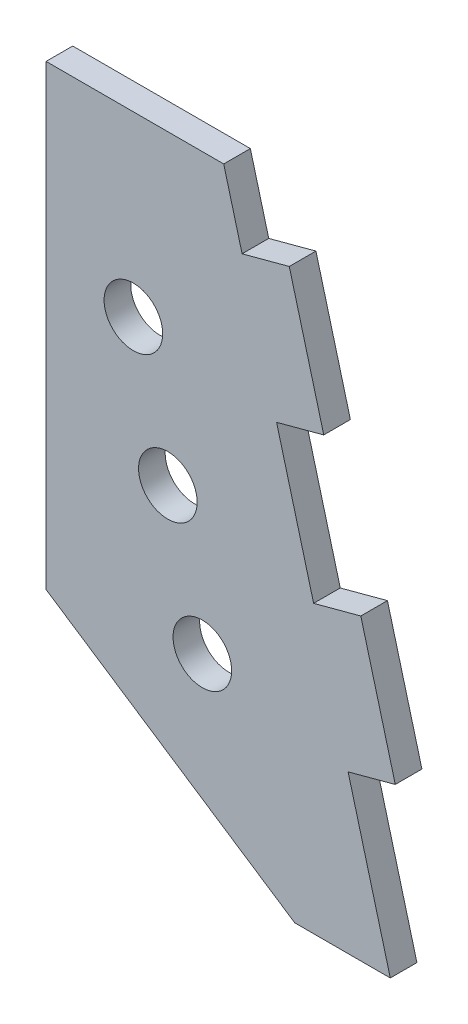
from build123d import *

# Parameters (mm, degrees)
RESSALTO_EXTRUS_O1_DEPTH = 3
FURO_COM_FOLGA_DE_M61_D  = 6.6
RESSALTO_EXTRUS_O2_DEPTH = 3
RESSALTO_EXTRUS_O3_DEPTH = 3
CORTE_EXTRUS_O1_DEPTH    = 72.798210781


with BuildPart() as part:
    # Esboço1 → Ressalto-extrusão1 (new body)
    with BuildSketch(Plane.XY):
        Polygon((0, 0), (0, 60), (20, 60), (36.076951546, 0), align=None)
    extrude(amount=RESSALTO_EXTRUS_O1_DEPTH)

    # Furo com folga de M61 (through all)
    with Locations(Plane.XY.offset(3)):
        with Locations((9.829841142, 40), (13.712126819, 25.511112606), (17.594412496, 11.022225211)):
            Hole(FURO_COM_FOLGA_DE_M61_D / 2)

    # Esboço4 → Ressalto-extrusão2 (add)
    with BuildSketch(Plane.XY.offset(3)):
        Polygon((22.070552361, 52.27259339), (27.383144405, 53.696098138), (31.265430082, 39.207210743), (25.952838037, 37.783705995), align=None)
        Polygon((30.124113509, 22.216294005), (35.436705553, 23.639798753), (39.31899123, 9.150911358), (34.006399185, 7.72740661), align=None)
    extrude(amount=-RESSALTO_EXTRUS_O2_DEPTH)

    # Esboço5 → Ressalto-extrusão3 (add)
    with BuildSketch(Plane.XY.offset(3)):
        Polygon((0, 0), (0, -10), (38.75644347, -10), (36.076951546, 0), align=None)
    extrude(amount=-RESSALTO_EXTRUS_O3_DEPTH)

    # Esboço6 → Corte-extrusão1 (cut, through all)
    with BuildSketch(Plane.XY.offset(3)):
        Polygon((0, 8.5), (0, -10), (28, -10), align=None)
    extrude(amount=-CORTE_EXTRUS_O1_DEPTH, mode=Mode.SUBTRACT)


solid = part.part
